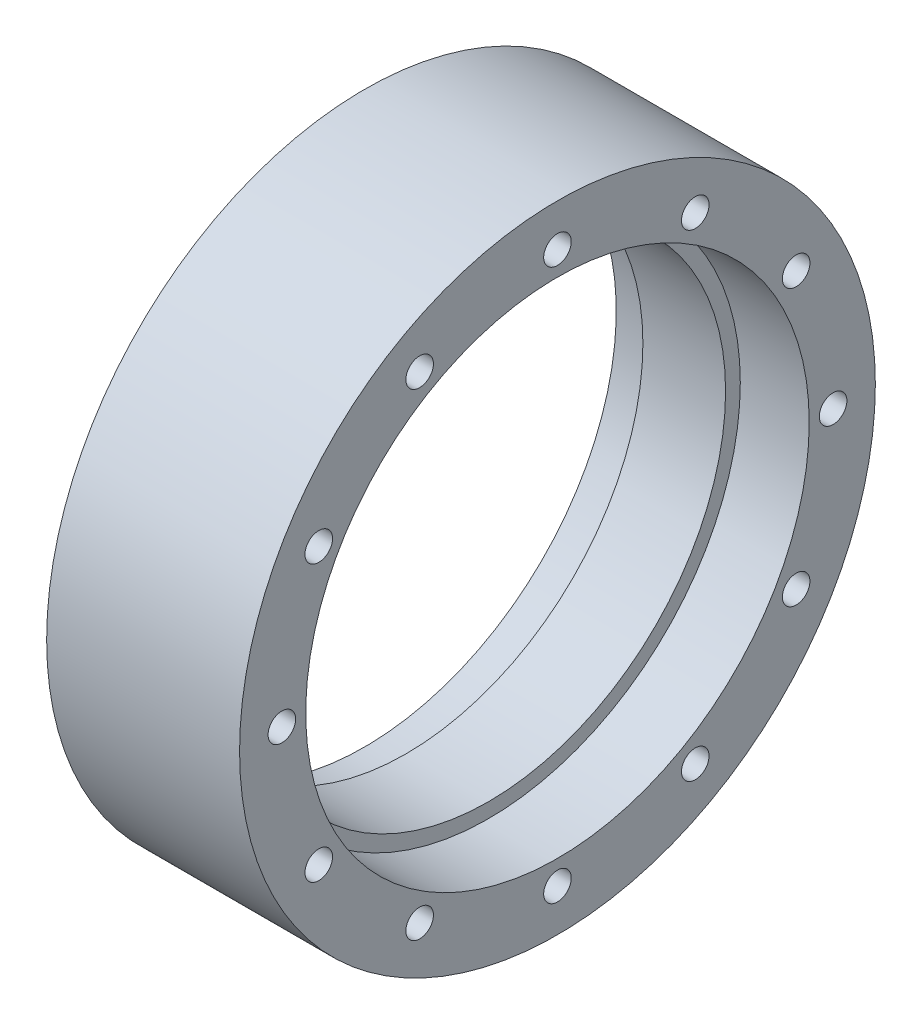
from build123d import *

# Parameters (mm, degrees)
SKETCH2_R           = 36.62
SKETCH2_R_2         = 29
BOSS_EXTRUDE1_DEPTH = 12.7
BOSS_EXTRUDE2_START = -12.7
SKETCH4_R           = 36.62
SKETCH4_R_2         = 27.305
BOSS_EXTRUDE2_DEPTH = 4.7625
SKETCH5_R           = 1.5875
CUT_EXTRUDE2_DEPTH  = 58.681962519
SKETCH6_R           = 63.5
CUT_EXTRUDE3_DEPTH  = 3.175


with BuildPart() as part:
    # Sketch2 → Boss-Extrude1 (new, symmetric)
    with BuildSketch(Plane(origin=(0, 0, 0), x_dir=(0, 0, -1), z_dir=(1, 0, 0))):
        Circle(SKETCH2_R)
        Circle(SKETCH2_R_2, mode=Mode.SUBTRACT)
    extrude(amount=BOSS_EXTRUDE1_DEPTH, both=True)

    # Sketch4 → Boss-Extrude2 (add, symmetric)
    with BuildSketch(Plane.ZY.offset(12.7).offset(BOSS_EXTRUDE2_START)):
        with Locations(Location((0, 0, 0), (0, 0, 180))):
            Circle(SKETCH4_R)
        with Locations(Location((0, 0, 0), (0, 0, 180))):
            Circle(SKETCH4_R_2, mode=Mode.SUBTRACT)
    extrude(amount=BOSS_EXTRUDE2_DEPTH, both=True)

    # Sketch5 → Cut-Extrude2 (cut, through all)
    with BuildSketch(Plane(origin=(12.7, 0, 0), x_dir=(0, 0, -1), z_dir=(1, 0, 0))):
        with Locations((31.75, 0)):
            Circle(SKETCH5_R)
        with Locations((27.49630657, -15.875)):
            Circle(SKETCH5_R)
        with Locations((15.875, -27.49630657)):
            Circle(SKETCH5_R)
        with Locations((0, -31.75)):
            Circle(SKETCH5_R)
        with Locations((-15.875, -27.49630657)):
            Circle(SKETCH5_R)
        with Locations((-27.49630657, -15.875)):
            Circle(SKETCH5_R)
        with Locations((-31.75, 0)):
            Circle(SKETCH5_R)
        with Locations((-27.49630657, 15.875)):
            Circle(SKETCH5_R)
        with Locations((-15.875, 27.49630657)):
            Circle(SKETCH5_R)
        with Locations((0, 31.75)):
            Circle(SKETCH5_R)
        with Locations((15.875, 27.49630657)):
            Circle(SKETCH5_R)
        with Locations((27.49630657, 15.875)):
            Circle(SKETCH5_R)
    extrude(amount=-CUT_EXTRUDE2_DEPTH, mode=Mode.SUBTRACT)

    # Sketch6 → Cut-Extrude3 (cut)
    with BuildSketch(Plane.ZY.offset(12.7)):
        Circle(SKETCH6_R)
    extrude(amount=-CUT_EXTRUDE3_DEPTH, mode=Mode.SUBTRACT)


solid = part.part
